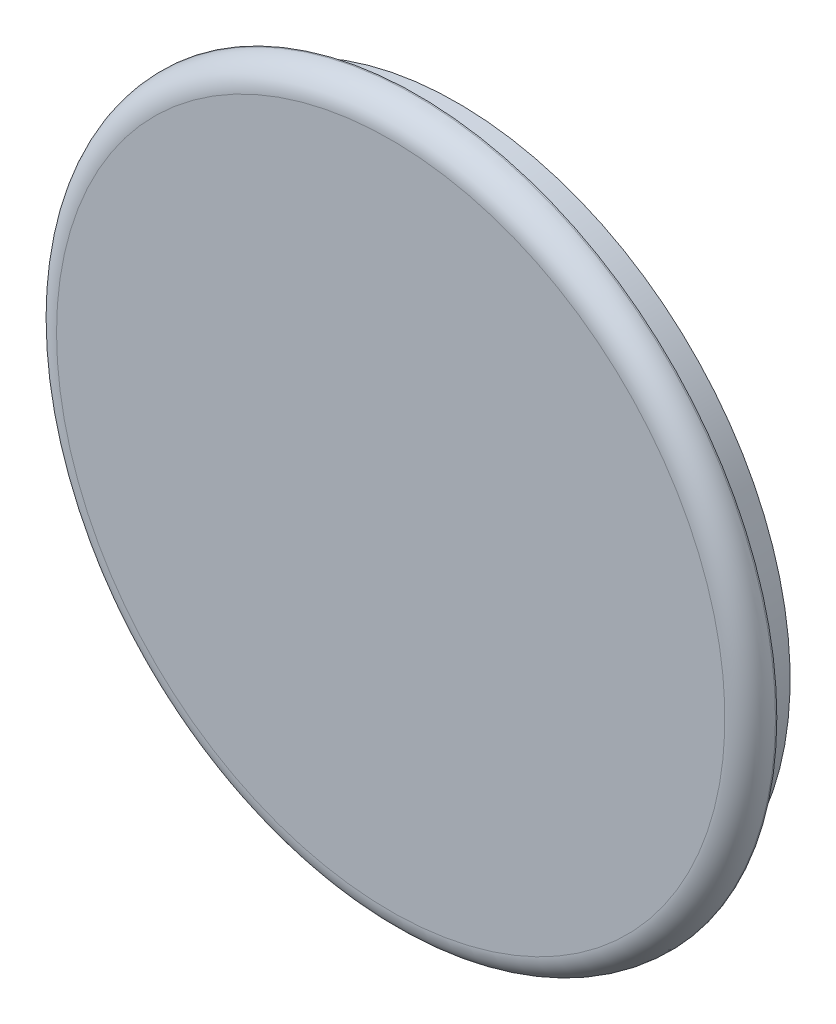
from build123d import *


with BuildPart() as part:
    # Sketch2 → Revolve1 (revolve)
    with BuildSketch(Plane(origin=(0, 0, 0), x_dir=(1, 0, 0), z_dir=(0, 1, 0)), mode=Mode.PRIVATE) as revolve1_sk:
        with BuildLine():
            Line((0, 0), (25.1, 0))
            ThreePointArc((25.1, 0), (26.443502884, 0.556497116), (27, 1.9))
            Line((27, 1.9), (27, 2))
            Line((27, 2), (25, 2))
            Line((25, 2), (25, 5))
            Line((25, 5), (23, 5))
            Line((23, 5), (23, 2))
            Line((23, 2), (0, 2))
            Line((0, 2), (0, 0))
        make_face()
    revolve(revolve1_sk.sketch.rotate(Axis((0, 0, -2), (0, 0, 1)), 180), axis=Axis((0, 0, -2), (0, 0, 1)))


solid = part.part
